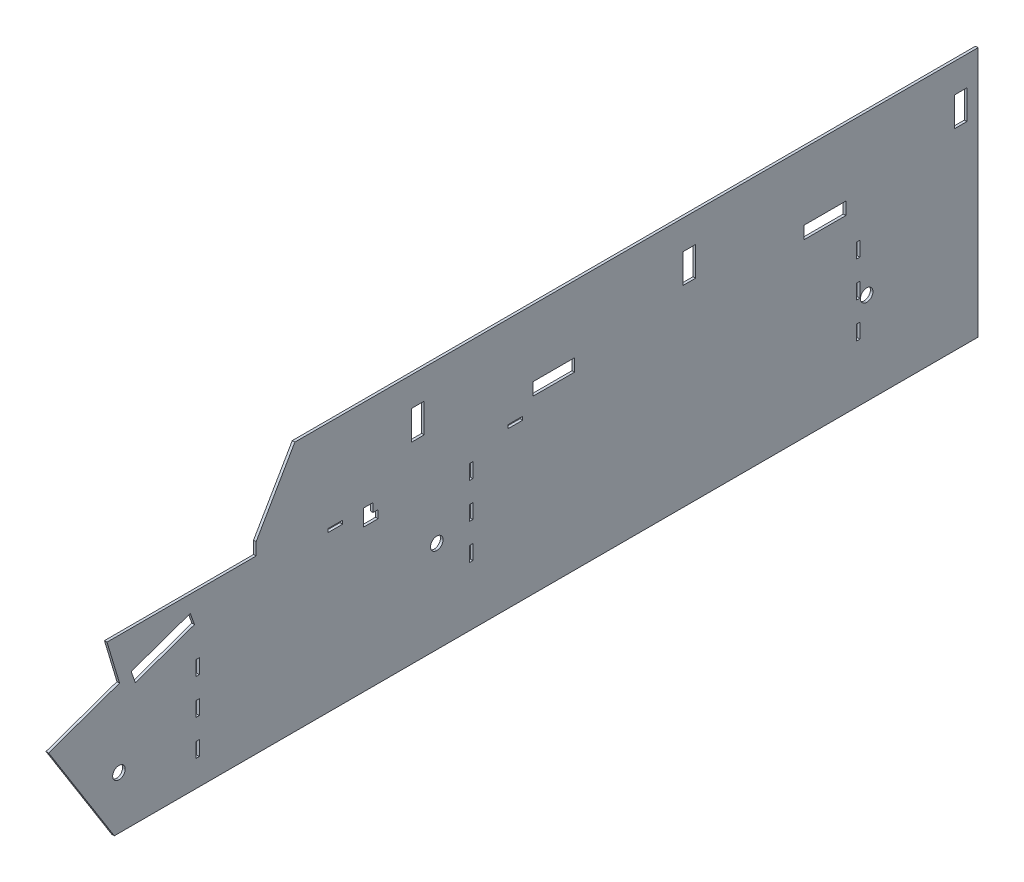
from build123d import *

# Parameters (mm, degrees)
SKETCH1_W           = 4
SKETCH1_H           = 17
SKETCH1_W_2         = 17
SKETCH1_H_2         = 4
SKETCH1_W_3         = 14.5201
SKETCH1_H_3         = 33.8773
SKETCH1_W_4         = 48.399
SKETCH1_H_4         = 14.5267
SKETCH1_W_5         = 48.409
SKETCH1_H_5         = 14.5201
SKETCH1_H_6         = 16.9197
SKETCH1_H_7         = 16.9198
BOSS_EXTRUDE2_DEPTH = 3


with BuildPart() as part:
    # Sketch1 → Boss-Extrude2 (new body)
    with BuildSketch(Plane(origin=(0, 0, 0), x_dir=(0, 0, -1), z_dir=(1, 0, 0))):
        Polygon((-503.9458, -26.8502), (-427.6871, -148.1709), (573.7687, -148.1709), (573.7687, 142.5497), (-218.3839, 142.5497), (-263.2513, 65.0539), (-263.2513, 50.6289), (-436.1861, 50.5939), (-421.6644, 2.1883), align=None)
        with Locations((434.7463, 9.1594)):
            Rectangle(SKETCH1_W, SKETCH1_H, mode=Mode.SUBTRACT)
        with Locations((37.2084, 34.4461)):
            Rectangle(SKETCH1_W_2, SKETCH1_H_2, mode=Mode.SUBTRACT)
        Polygon((-408.1165, 7.0272), (-339.6566, 31.1916), (-334.8227, 17.4953), (-403.2826, -6.6625), align=None, mode=Mode.SUBTRACT)
        with Locations((-75.60135, 91.73875)):
            Rectangle(SKETCH1_W_3, SKETCH1_H_3, mode=Mode.SUBTRACT)
        with Locations((81.6996, 57.85395)):
            Rectangle(SKETCH1_W_4, SKETCH1_H_4, mode=Mode.SUBTRACT)
        with Locations((239.00055, 91.73875)):
            Rectangle(SKETCH1_W_3, SKETCH1_H_3, mode=Mode.SUBTRACT)
        with Locations((396.3082, 57.85895)):
            Rectangle(SKETCH1_W_5, SKETCH1_H_5, mode=Mode.SUBTRACT)
        with Locations((553.60245, 91.73875)):
            Rectangle(SKETCH1_W_3, SKETCH1_H_3, mode=Mode.SUBTRACT)
        with Locations((-331.1886, -27.0339)):
            Rectangle(SKETCH1_W, SKETCH1_H, mode=Mode.SUBTRACT)
        with Locations((-331.1886, -68.18055)):
            Rectangle(SKETCH1_W, SKETCH1_H_6, mode=Mode.SUBTRACT)
        with Locations((-331.1886, -109.3272)):
            Rectangle(SKETCH1_W, SKETCH1_H, mode=Mode.SUBTRACT)
        with Locations((-171.5395, 34.4461)):
            Rectangle(SKETCH1_W_2, SKETCH1_H_2, mode=Mode.SUBTRACT)
        Polygon((-127.6656, 36.4461), (-127.6656, 26.4461), (-121.933, 26.4461), (-121.933, 17.3384), (-138.8528, 17.3384), (-138.8528, 36.4461), align=None, mode=Mode.SUBTRACT)
        with Locations((-14, 11.2)):
            Rectangle(SKETCH1_W, SKETCH1_H, mode=Mode.SUBTRACT)
        with Locations((-14, -29.9466)):
            Rectangle(SKETCH1_W, SKETCH1_H_7, mode=Mode.SUBTRACT)
        with Locations((-14, -71.0932)):
            Rectangle(SKETCH1_W, SKETCH1_H, mode=Mode.SUBTRACT)
        with Locations((434.7463, -31.9872)):
            Rectangle(SKETCH1_W, SKETCH1_H_7, mode=Mode.SUBTRACT)
        with Locations((434.7463, -73.1338)):
            Rectangle(SKETCH1_W, SKETCH1_H, mode=Mode.SUBTRACT)
        with BuildLine():
            add(Edge.make_bspline(
                [(444.7022, -48.6335), (440.6903, -48.6335), (437.4421, -45.382), (437.4421, -41.3735)],
                knots=[0, 0, 0, 0, 0.333333333, 0.333333333, 0.333333333, 0.333333333], degree=3))
            add(Edge.make_bspline(
                [(437.4421, -41.3735), (437.4421, -37.3617), (440.6937, -34.1135), (444.7022, -34.1135)],
                knots=[0.333333333, 0.333333333, 0.333333333, 0.333333333, 1, 1, 1, 1], degree=3))
            add(Edge.make_bspline(
                [(444.7022, -34.1135), (448.7124, -34.1135), (451.9639, -37.3617), (451.9639, -41.3735)],
                knots=[0, 0, 0, 0, 0.333333333, 0.333333333, 0.333333333, 0.333333333], degree=3))
            add(Edge.make_bspline(
                [(451.9639, -41.3735), (451.9639, -45.372), (448.7124, -48.6335), (444.7022, -48.6335)],
                knots=[0.333333333, 0.333333333, 0.333333333, 0.333333333, 1, 1, 1, 1], degree=3))
        make_face(mode=Mode.SUBTRACT)
        with BuildLine():
            add(Edge.make_bspline(
                [(-53.8196, -48.6335), (-57.8298, -48.6335), (-61.0797, -45.382), (-61.0797, -41.3735)],
                knots=[0, 0, 0, 0, 0.333333333, 0.333333333, 0.333333333, 0.333333333], degree=3))
            add(Edge.make_bspline(
                [(-61.0797, -41.3735), (-61.0797, -37.3617), (-57.8282, -34.1135), (-53.8196, -34.1135)],
                knots=[0.333333333, 0.333333333, 0.333333333, 0.333333333, 1, 1, 1, 1], degree=3))
            add(Edge.make_bspline(
                [(-53.8196, -34.1135), (-49.8111, -34.1135), (-46.5596, -37.3617), (-46.5596, -41.3735)],
                knots=[0, 0, 0, 0, 0.333333333, 0.333333333, 0.333333333, 0.333333333], degree=3))
            add(Edge.make_bspline(
                [(-46.5596, -41.3735), (-46.5596, -45.372), (-49.8111, -48.6335), (-53.8196, -48.6335)],
                knots=[0.333333333, 0.333333333, 0.333333333, 0.333333333, 1, 1, 1, 1], degree=3))
        make_face(mode=Mode.SUBTRACT)
        with BuildLine():
            add(Edge.make_bspline(
                [(-422.3548, -94.6631), (-426.3633, -94.6631), (-429.6148, -91.4116), (-429.6148, -87.4031)],
                knots=[0, 0, 0, 0, 0.333333333, 0.333333333, 0.333333333, 0.333333333], degree=3))
            add(Edge.make_bspline(
                [(-429.6148, -87.4031), (-429.6148, -83.3946), (-426.3633, -80.1431), (-422.3548, -80.1431)],
                knots=[0.333333333, 0.333333333, 0.333333333, 0.333333333, 1, 1, 1, 1], degree=3))
            add(Edge.make_bspline(
                [(-422.3548, -80.1431), (-418.3462, -80.1431), (-415.0947, -83.3946), (-415.0947, -87.4031)],
                knots=[0, 0, 0, 0, 0.333333333, 0.333333333, 0.333333333, 0.333333333], degree=3))
            add(Edge.make_bspline(
                [(-415.0947, -87.4031), (-415.0947, -91.4116), (-418.3462, -94.6631), (-422.3548, -94.6631)],
                knots=[0.333333333, 0.333333333, 0.333333333, 0.333333333, 1, 1, 1, 1], degree=3))
        make_face(mode=Mode.SUBTRACT)
    extrude(amount=BOSS_EXTRUDE2_DEPTH)


solid = part.part
